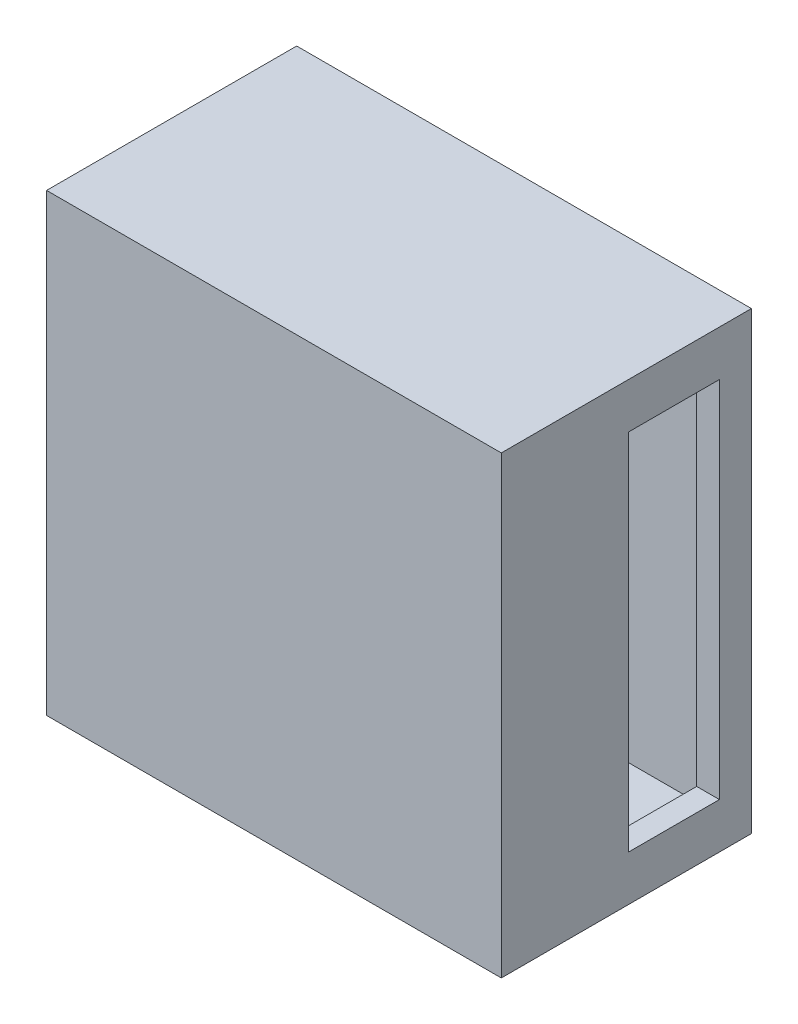
from build123d import *

# Parameters (mm, degrees)
SKETCH1_W           = 100
SKETCH1_H           = 100
BOSS_EXTRUDE1_DEPTH = 50
SHELL1_T            = -5
SKETCH2_W           = 20
SKETCH2_H           = 80
CUT_EXTRUDE1_DEPTH  = 19
SKETCH3_W           = 100
SKETCH3_H           = 100
BOSS_EXTRUDE2_DEPTH = 5


with BuildPart() as part:
    # Sketch1 → Boss-Extrude1 (new body)
    with BuildSketch(Plane.XY):
        Rectangle(SKETCH1_W, SKETCH1_H)
    extrude(amount=BOSS_EXTRUDE1_DEPTH)

    # Shell1
    shell1_openings = [part.faces().sort_by_distance(p)[0] for p in [
        (0, 0, 50),
    ]]
    offset(amount=SHELL1_T, openings=shell1_openings, kind=Kind.INTERSECTION)

    # Sketch2 → Cut-Extrude1 (cut)
    with BuildSketch(Plane(origin=(50, 0, 0), x_dir=(0, 0, -1), z_dir=(1, 0, 0))):
        with Locations((-17.036919811, 0)):
            Rectangle(SKETCH2_W, SKETCH2_H)
    extrude(amount=-CUT_EXTRUDE1_DEPTH, mode=Mode.SUBTRACT)

    # Sketch3 → Boss-Extrude2 (add)
    with BuildSketch(Plane.XY.offset(50)):
        Rectangle(SKETCH3_W, SKETCH3_H)
    extrude(amount=BOSS_EXTRUDE2_DEPTH)


solid = part.part
